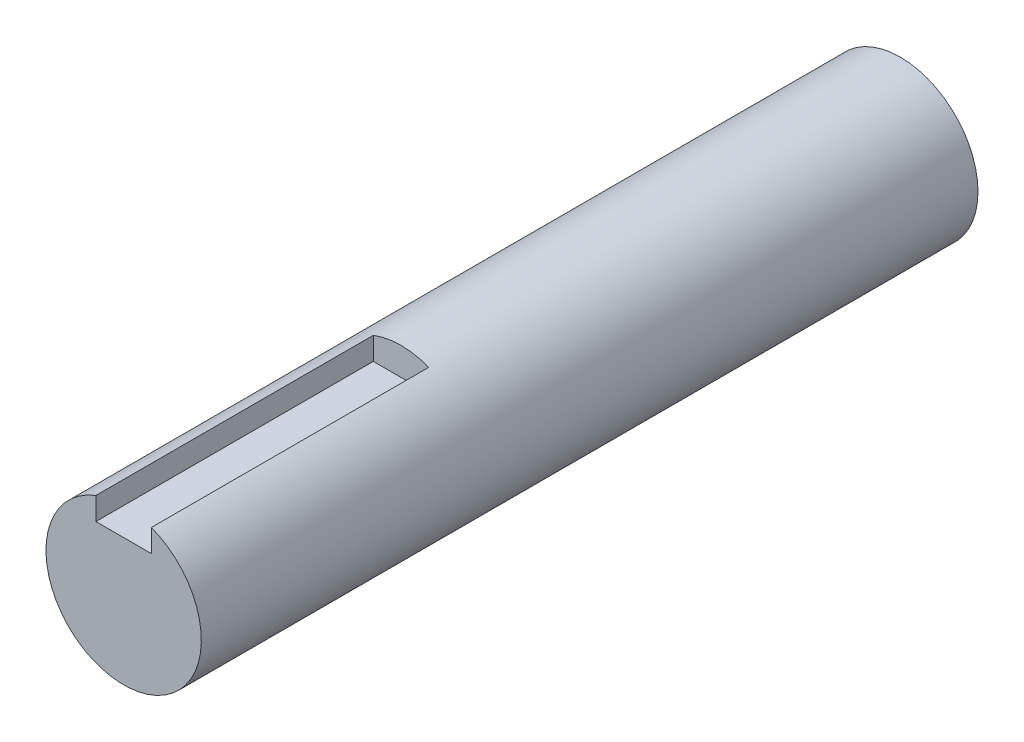
from build123d import *

# Parameters (mm, degrees)
SKETCH1_R           = 7
BOSS_EXTRUDE1_DEPTH = 70
CUT_EXTRUDE1_START  = -25
CUT_EXTRUDE1_DEPTH  = 25


with BuildPart() as part:
    # Sketch1 → Boss-Extrude1 (new body)
    with BuildSketch(Plane.XY):
        Circle(SKETCH1_R)
    extrude(amount=BOSS_EXTRUDE1_DEPTH)

    # Sketch2 → Cut-Extrude1 (cut)
    with BuildSketch(Plane.XY.offset(70).offset(CUT_EXTRUDE1_START)):
        with BuildLine():
            Line((-2.5, 4.5), (2.5, 4.5))
            Line((2.5, 4.5), (2.5, 6.538348415))
            ThreePointArc((2.5, 6.538348415), (0, 7), (-2.5, 6.538348415))
            Line((-2.5, 6.538348415), (-2.5, 4.5))
        make_face()
    extrude(amount=CUT_EXTRUDE1_DEPTH, mode=Mode.SUBTRACT)


solid = part.part
